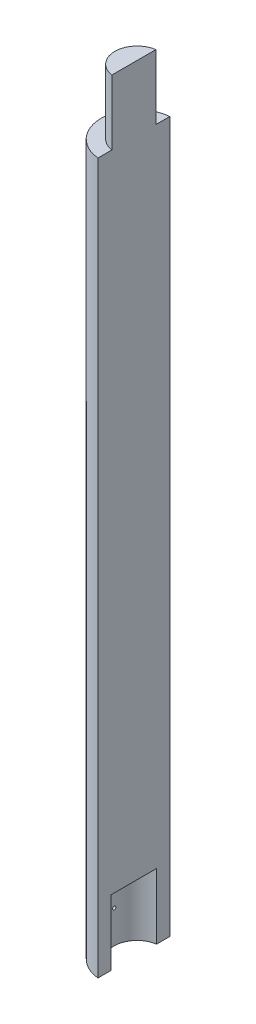
from build123d import *

# Parameters (mm, degrees)
BOSS_EXTRUDE1_DEPTH     = 216.66667
BOSS_EXTRUDE2_START     = 216.66667
BOSS_EXTRUDE2_DEPTH     = 19.8
CUT_EXTRUDE2_START      = -1.4
SKETCH4_R               = 0.5
CUT_EXTRUDE2_DEPTH      = 9
SKETCH6_R               = 7
CUT_EXTRUDE3_DEPTH      = 20
CUT_EXTRUDE4_DEPTH      = 237.977817671
CUT_EXTRUDE4_DEPTH_BACK = 20
SKETCH7_R               = 0.5
CUT_EXTRUDE5_DEPTH      = 237.97781768
CUT_EXTRUDE5_DEPTH_BACK = 237.97781768
SKETCH10_R              = 0.5
CUT_EXTRUDE6_DEPTH      = 237.97781768
CUT_EXTRUDE6_DEPTH_BACK = 237.97781768
SKETCH11_W              = 3.5
SKETCH11_H              = 216.66667
CUT_EXTRUDE7_DEPTH      = 237.975709212
CUT_EXTRUDE7_DEPTH_BACK = 237.975709212
SKETCH12_W              = 3.499316008
SKETCH12_H              = 20


with BuildPart() as part:
    # Sketch1 → Boss-Extrude1 (new body)
    with BuildSketch(Plane(origin=(0, 0, 0), x_dir=(1, 0, 0), z_dir=(0, 1, 0))):
        with BuildLine():
            Line((0, 11), (0, -11))
            ThreePointArc((0, -11), (-11, 0), (0, 11))
        make_face()
    extrude(amount=BOSS_EXTRUDE1_DEPTH)

    # Sketch2 → Boss-Extrude2 (add)
    with BuildSketch(Plane(origin=(0, 0, 0), x_dir=(1, 0, 0), z_dir=(0, 1, 0)).offset(BOSS_EXTRUDE2_START)):
        with BuildLine():
            Line((0, 6.8), (0, -6.8))
            ThreePointArc((0, -6.8), (-6.8, 0), (0, 6.8))
        make_face()
    extrude(amount=BOSS_EXTRUDE2_DEPTH)

    # Sketch4 → Cut-Extrude2 (cut)
    with BuildSketch(Plane(origin=(0, 0, 0), x_dir=(0, 0, -1), z_dir=(1, 0, 0)).offset(CUT_EXTRUDE2_START)):
        with Locations((0, 226.66667)):
            Circle(SKETCH4_R)
    extrude(amount=-CUT_EXTRUDE2_DEPTH, mode=Mode.SUBTRACT)

    # Sketch6 → Cut-Extrude3 (cut)
    with BuildSketch(Plane(origin=(0, 0, 0), x_dir=(1, 0, 0), z_dir=(0, 1, 0))):
        Circle(SKETCH6_R)
    extrude(amount=CUT_EXTRUDE3_DEPTH, mode=Mode.SUBTRACT)

    # Sketch7 → Cut-Extrude4 (cut, two sides: drawn at the far end of the back side and taken through both)
    with BuildSketch(Plane(origin=(0, 0, 0), x_dir=(0, 0, -1), z_dir=(1, 0, 0)).offset(-CUT_EXTRUDE4_DEPTH_BACK)):
        with Locations(Location((0, 10, 0), (0, 0, 180))):
            Circle(SKETCH7_R)
    extrude(amount=CUT_EXTRUDE4_DEPTH + CUT_EXTRUDE4_DEPTH_BACK, mode=Mode.SUBTRACT)

    # Sketch10 → Cut-Extrude5 (cut, two sides: drawn at the far end of the back side and taken through both)
    with BuildSketch(Plane.XY.offset(-CUT_EXTRUDE5_DEPTH_BACK)):
        with Locations((0, 5)):
            Circle(SKETCH10_R)
    extrude(amount=CUT_EXTRUDE5_DEPTH + CUT_EXTRUDE5_DEPTH_BACK, mode=Mode.SUBTRACT)

    # Sketch11 → Cut-Extrude6 (cut, two sides: drawn at the far end of the back side and taken through both)
    with BuildSketch(Plane.XY.offset(-CUT_EXTRUDE6_DEPTH_BACK)):
        with Locations((0.750341996, 108.333335)):
            Rectangle(SKETCH11_W, SKETCH11_H)
    extrude(amount=CUT_EXTRUDE6_DEPTH + CUT_EXTRUDE6_DEPTH_BACK, mode=Mode.SUBTRACT)

    # Sketch12 → Cut-Extrude7 (cut, two sides: drawn at the far end of the back side and taken through both)
    with BuildSketch(Plane.XY.offset(-CUT_EXTRUDE7_DEPTH_BACK)):
        with Locations((0.75, 226.66667)):
            Rectangle(SKETCH12_W, SKETCH12_H)
    extrude(amount=CUT_EXTRUDE7_DEPTH + CUT_EXTRUDE7_DEPTH_BACK, mode=Mode.SUBTRACT)


solid = part.part
